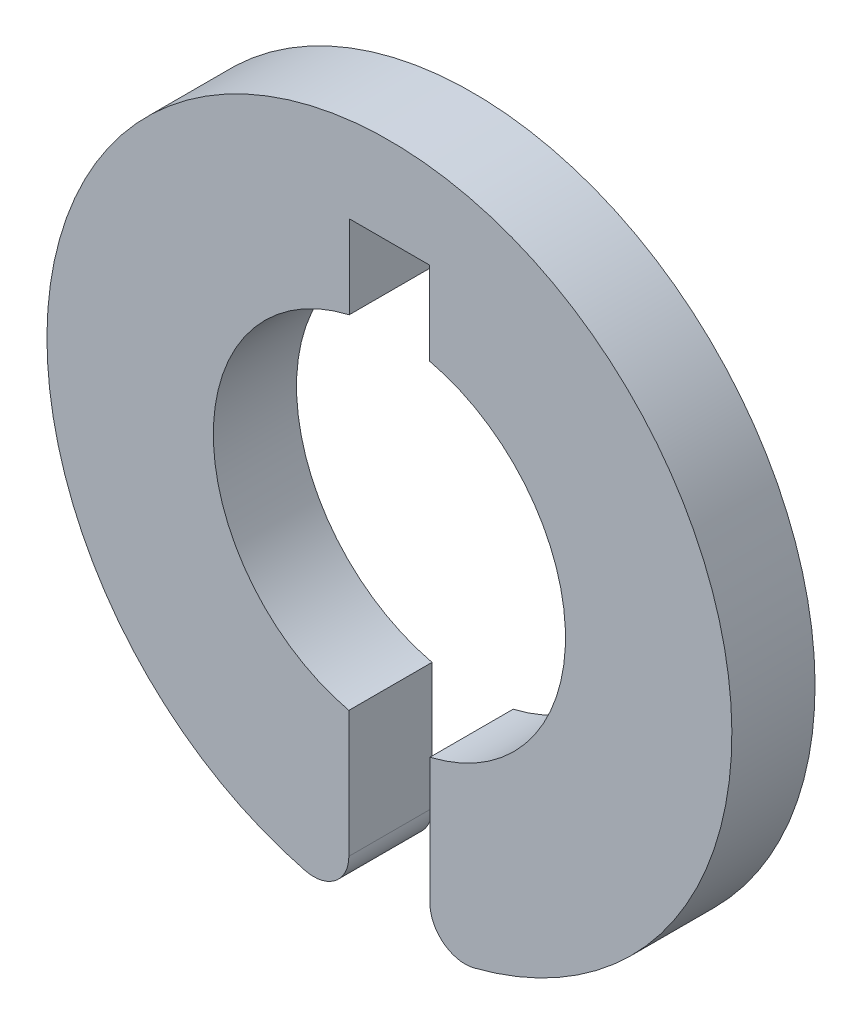
from build123d import *

# Parameters (mm, degrees)
EXTRUDE_1_DEPTH = 3
FILLET_1_R      = 1.27


with BuildPart() as part:
    # 스케치1 → 보스-돌출1 (new body)
    with BuildSketch(Plane.XY):
        with BuildLine():
            Line((-1.4475, 9.182818431), (1.4475, 9.182818431))
            Line((1.4475, 9.182818431), (1.4475, 6.182818431))
            ThreePointArc((1.4475, 6.182818431), (6.349995325, 0.007704992), (1.4625, -6.179287479))
            Line((1.4625, -6.179287479), (1.4625, -12.263098864))
            ThreePointArc((1.4625, -12.263098864), (0, 12.35), (-1.4625, -12.263098864))
            Line((-1.4625, -12.263098864), (-1.4625, -6.179287479))
            ThreePointArc((-1.4625, -6.179287479), (-6.349995325, 0.007704992), (-1.4475, 6.182818431))
            Line((-1.4475, 6.182818431), (-1.4475, 9.182818431))
        make_face()
    extrude(amount=EXTRUDE_1_DEPTH)

    # 필렛1
    fillet_1_edges = [part.edges().sort_by_distance(p)[0] for p in [
        (-1.4625, -12.263098864, 1.5),
        (1.4625, -12.263098864, 1.5),
    ]]
    fillet(fillet_1_edges, radius=FILLET_1_R)


solid = part.part
